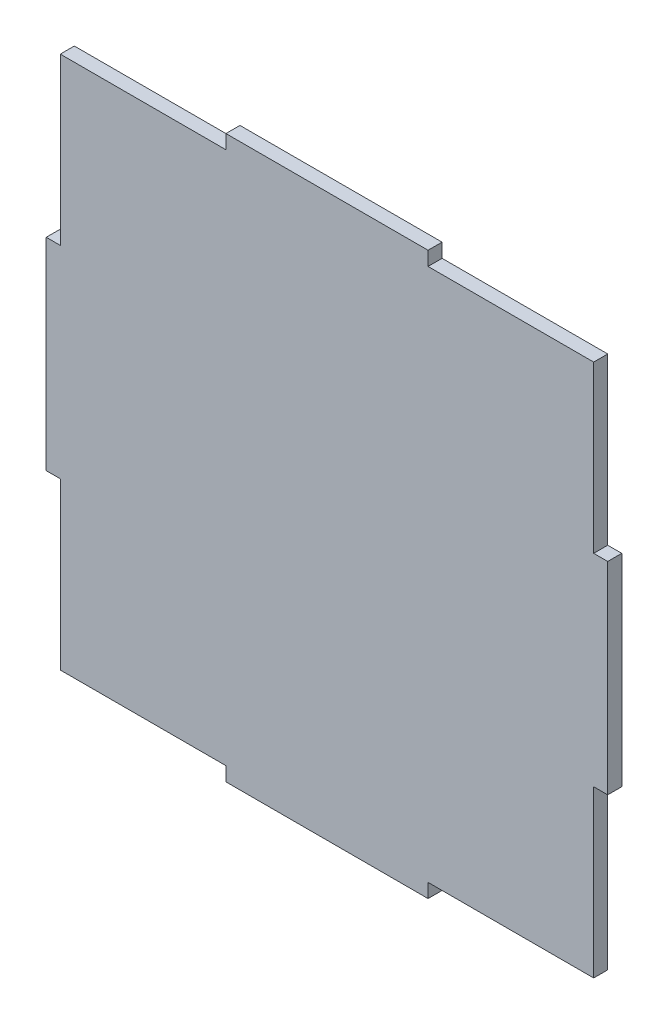
from build123d import *

# Parameters (mm, degrees)
BOSS_EXTRUDE1_DEPTH = 5


with BuildPart() as part:
    # Sketch1 → Boss-Extrude1 (new body)
    with BuildSketch(Plane.XY):
        Polygon((36, 100), (-36, 100), (-36, 95), (-95, 95), (-95, 36), (-100, 36), (-100, -36), (-95, -36), (-95, -95), (-36, -95), (-36, -100), (36, -100), (36, -95), (95, -95), (95, -36), (100, -36), (100, 36), (95, 36), (95, 95), (36, 95), align=None)
    extrude(amount=BOSS_EXTRUDE1_DEPTH)


solid = part.part
